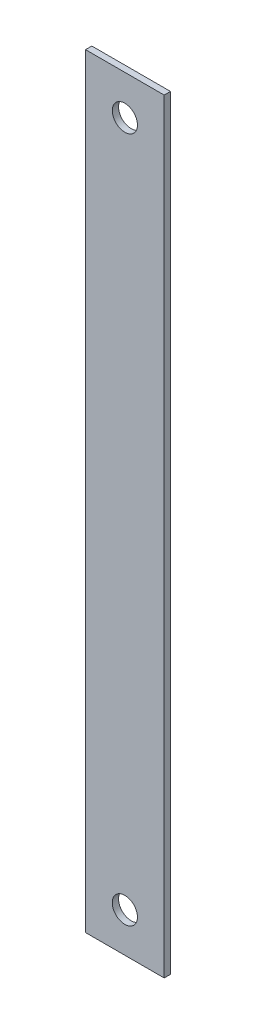
from build123d import *

# Parameters (mm, degrees)
SKETCH1_R           = 4
BOSS_EXTRUDE1_DEPTH = 2


with BuildPart() as part:
    # Sketch1 → Boss-Extrude1 (new body)
    with BuildSketch(Plane.XY):
        Polygon((3.5, 121.5), (12.5, 121.5), (12.5, -121.5), (3.5, -121.5), (0, -121.5), (-12.5, -121.5), (-12.5, -115.487492178), (-12.5, -105.5), (-12.5, 112.5), (-12.5, 121.482064427), (-12.5, 121.5), (0, 121.5), align=None)
        with Locations((0, 109)):
            Circle(SKETCH1_R, mode=Mode.SUBTRACT)
        with Locations(Location((0, -109, 0), (0, 0, 180))):
            Circle(SKETCH1_R, mode=Mode.SUBTRACT)
    extrude(amount=BOSS_EXTRUDE1_DEPTH)


solid = part.part
